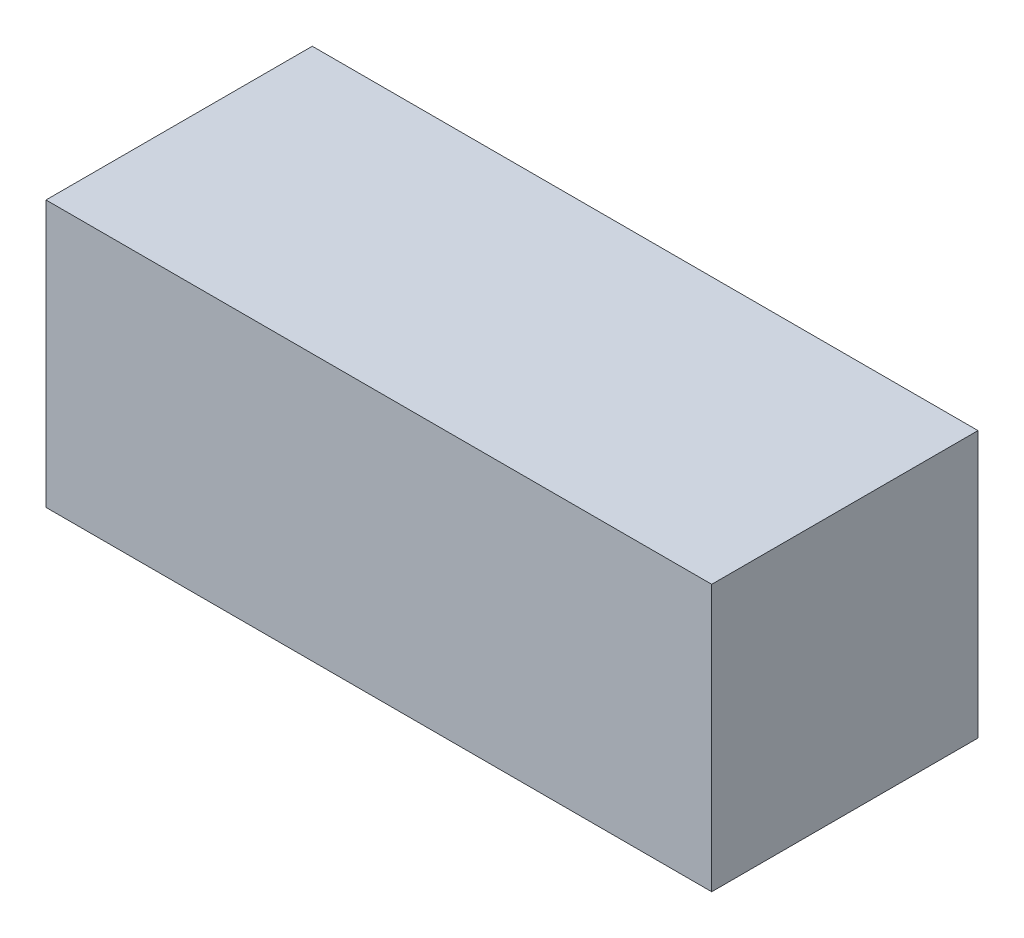
from build123d import *

# Parameters (mm, degrees)
SKETCH_1_W      = 50
SKETCH_1_H      = 20
EXTRUDE_1_DEPTH = 20


with BuildPart() as part:
    # 스케치1 → 보스-돌출1 (new body)
    with BuildSketch(Plane(origin=(0, 0, 0), x_dir=(1, 0, 0), z_dir=(0, 1, 0))):
        Rectangle(SKETCH_1_W, SKETCH_1_H)
    extrude(amount=EXTRUDE_1_DEPTH)


solid = part.part
